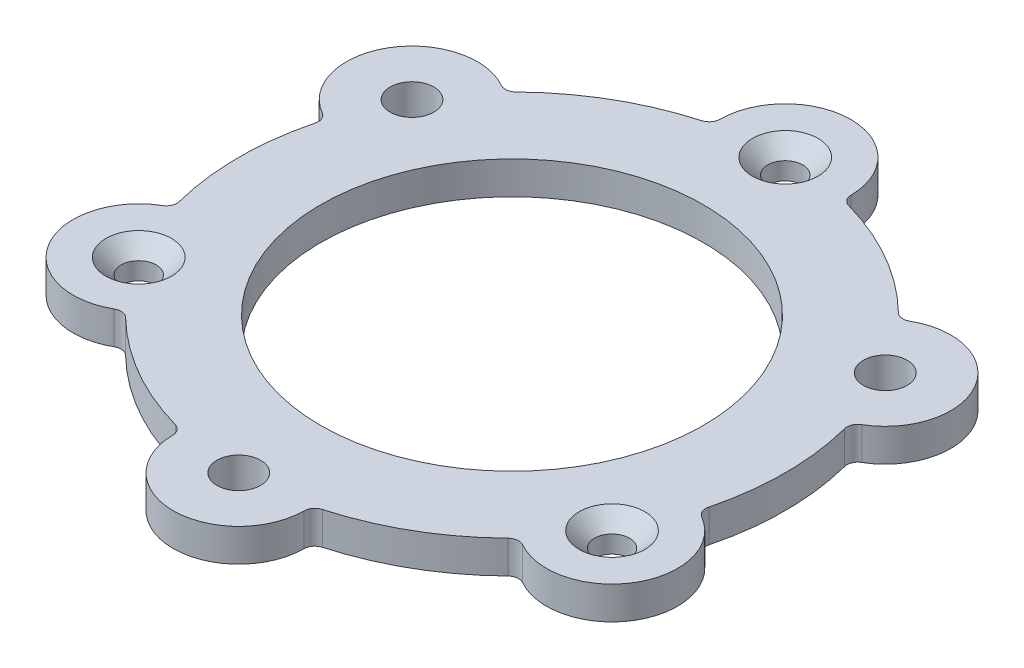
from build123d import *

# Parameters (mm, degrees)
SKETCH1_R                     = 8.75
SKETCH1_R_2                   = 1
BOSS_EXTRUDE1_DEPTH           = 1.5
CSK_FOR_M3_SFHCS1_D           = 1.6
CSK_FOR_M3_SFHCS1_DEPTH       = 7.5
CSK_FOR_M3_SFHCS1_CSINK_D     = 3
CSK_FOR_M3_SFHCS1_CSINK_ANGLE = 90
CSK_FOR_M3_SFHCS1_TIP         = 0.480688495
FILLET1_R                     = 0.5


with BuildPart() as part:
    # Sketch1 → Boss-Extrude1 (new body)
    with BuildSketch(Plane(origin=(0, 0, 0), x_dir=(1, 0, 0), z_dir=(0, 1, 0))):
        with BuildLine():
            Line((-3, -12.1346611), (-3, -12.5))
            ThreePointArc((-3, -12.5), (0, -15.5), (3, -12.5))
            Line((3, -12.5), (3, -12.1346611))
            ThreePointArc((3, -12.1346611), (6.25, -10.825317547), (9.008924778, -8.665406761))
            Line((9.008924778, -8.665406761), (9.325317547, -8.848076211))
            ThreePointArc((9.325317547, -8.848076211), (13.423393759, -7.75), (12.325317547, -3.651923789))
            Line((12.325317547, -3.651923789), (12.008924778, -3.469254338))
            ThreePointArc((12.008924778, -3.469254338), (12.5, 0), (12.008924778, 3.469254338))
            Line((12.008924778, 3.469254338), (12.325317547, 3.651923789))
            ThreePointArc((12.325317547, 3.651923789), (13.423393759, 7.75), (9.325317547, 8.848076211))
            Line((9.325317547, 8.848076211), (9.008924778, 8.665406761))
            ThreePointArc((9.008924778, 8.665406761), (6.25, 10.825317547), (3, 12.1346611))
            Line((3, 12.1346611), (3, 12.5))
            ThreePointArc((3, 12.5), (0, 15.5), (-3, 12.5))
            Line((-3, 12.5), (-3, 12.1346611))
            ThreePointArc((-3, 12.1346611), (-6.25, 10.825317547), (-9.008924778, 8.665406761))
            Line((-9.008924778, 8.665406761), (-9.325317547, 8.848076211))
            ThreePointArc((-9.325317547, 8.848076211), (-13.423393759, 7.75), (-12.325317547, 3.651923789))
            Line((-12.325317547, 3.651923789), (-12.008924778, 3.469254338))
            ThreePointArc((-12.008924778, 3.469254338), (-12.5, 0), (-12.008924778, -3.469254338))
            Line((-12.008924778, -3.469254338), (-12.325317547, -3.651923789))
            ThreePointArc((-12.325317547, -3.651923789), (-13.423393759, -7.75), (-9.325317547, -8.848076211))
            Line((-9.325317547, -8.848076211), (-9.008924778, -8.665406761))
            ThreePointArc((-9.008924778, -8.665406761), (-6.25, -10.825317547), (-3, -12.1346611))
        make_face()
        with Locations(Location((0, 0, 0), (0, 0, 270))):
            Circle(SKETCH1_R, mode=Mode.SUBTRACT)
        with Locations(Location((-10.825317547, 6.25, 0), (0, 0, 270))):
            Circle(SKETCH1_R_2, mode=Mode.SUBTRACT)
        with Locations(Location((10.825317547, 6.25, 0), (0, 0, 270))):
            Circle(SKETCH1_R_2, mode=Mode.SUBTRACT)
        with Locations(Location((0, -12.5, 0), (0, 0, 270))):
            Circle(SKETCH1_R_2, mode=Mode.SUBTRACT)
    extrude(amount=BOSS_EXTRUDE1_DEPTH)

    # CSK for M3 SFHCS1
    with Locations(Plane(origin=(-10.825317547, 1.5, 6.25), x_dir=(0, 0, 1), z_dir=(0, 1, 0))):
        with Locations((0, 0), (-18.75, 10.825317547), (0, 21.650635094)):
            CounterSinkHole(CSK_FOR_M3_SFHCS1_D / 2, CSK_FOR_M3_SFHCS1_CSINK_D / 2, depth=CSK_FOR_M3_SFHCS1_DEPTH, counter_sink_angle=CSK_FOR_M3_SFHCS1_CSINK_ANGLE)
            with Locations((0, 0, -(CSK_FOR_M3_SFHCS1_DEPTH + CSK_FOR_M3_SFHCS1_TIP / 2))):  # 118° drill point
                Cone(0, CSK_FOR_M3_SFHCS1_D / 2, CSK_FOR_M3_SFHCS1_TIP, mode=Mode.SUBTRACT)

    # Fillet1
    fillet1_edges = [part.edges().sort_by_distance(p)[0] for p in [
        (-3, 0.75, 12.1346611),
        (3, 0.75, 12.1346611),
        (9.008924778, 0.75, 8.665406761),
        (12.008924778, 0.75, 3.469254338),
        (12.008924778, 0.75, -3.469254338),
        (9.008924778, 0.75, -8.665406761),
        (3, 0.75, -12.1346611),
        (-3, 0.75, -12.1346611),
        (-9.008924778, 0.75, -8.665406761),
        (-12.008924778, 0.75, -3.469254338),
        (-12.008924778, 0.75, 3.469254338),
        (-9.008924778, 0.75, 8.665406761),
    ]]
    fillet(fillet1_edges, radius=FILLET1_R)


solid = part.part
